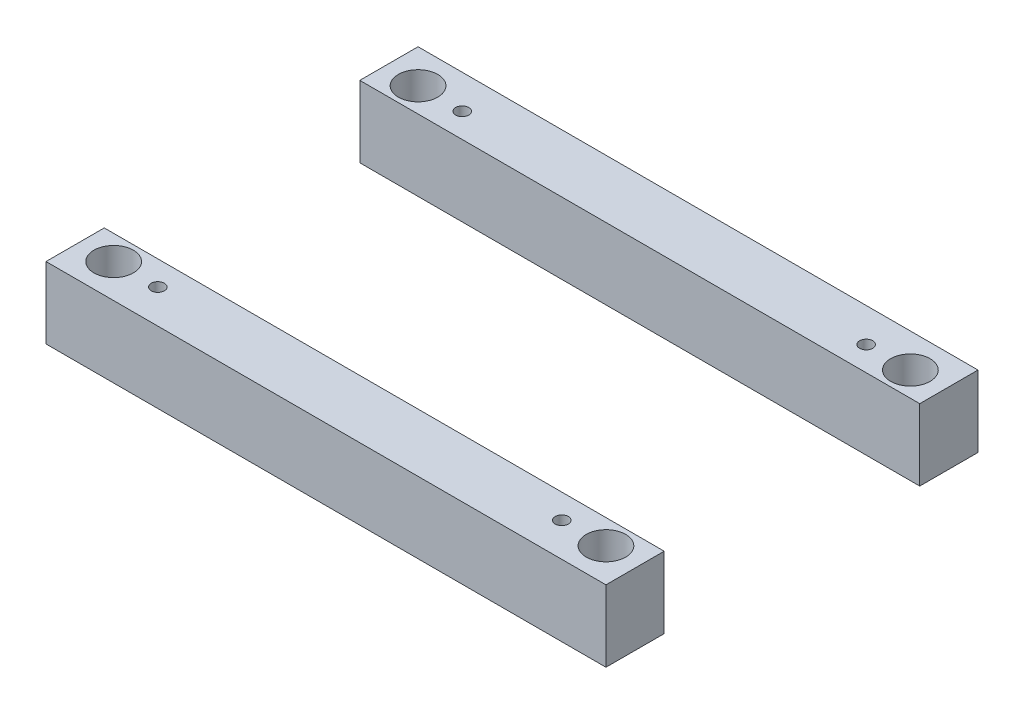
from build123d import *

# Parameters (mm, degrees)
SZKIC1_W                    = 596
SZKIC1_H                    = 396
SZKIC1_R                    = 24
SZKIC1_R_2                  = 21
DODANIE_WYCI_GNI_CIE1_DEPTH = 76
OTW_R_GWINTOWANY_M161_D     = 14
SZKIC4_W                    = 668.849986018
SZKIC4_H                    = 272
WYTNIJ_WYCI_GNI_CIE1_DEPTH  = 108


with BuildPart() as part:
    # Szkic1 → Dodanie-wyciągnięcie1 (new body)
    # profile 1 of 5: a face of its own
    with BuildSketch(Plane(origin=(0, 0, 0), x_dir=(1, 0, 0), z_dir=(0, 1, 0))):
        with Locations((298, 198)):
            Rectangle(SZKIC1_W, SZKIC1_H)
        with Locations((560, 360)):
            Circle(SZKIC1_R, mode=Mode.SUBTRACT)
        with Locations((36, 360)):
            Circle(SZKIC1_R, mode=Mode.SUBTRACT)
        with Locations((560, 36)):
            Circle(SZKIC1_R, mode=Mode.SUBTRACT)
        with Locations((36, 36)):
            Circle(SZKIC1_R, mode=Mode.SUBTRACT)
    # profile 2 of 5: a face of its own
    with BuildSketch(Plane(origin=(0, 0, 0), x_dir=(1, 0, 0), z_dir=(0, 1, 0))):
        with Locations((36, 36)):
            Circle(SZKIC1_R)
        with Locations(Location((36, 36, 0), (0, 0, 270))):
            Circle(SZKIC1_R_2, mode=Mode.SUBTRACT)
    # profile 3 of 5: a face of its own
    with BuildSketch(Plane(origin=(0, 0, 0), x_dir=(1, 0, 0), z_dir=(0, 1, 0))):
        with Locations((560, 36)):
            Circle(SZKIC1_R)
        with Locations(Location((560, 36, 0), (0, 0, 270))):
            Circle(SZKIC1_R_2, mode=Mode.SUBTRACT)
    # profile 4 of 5: a face of its own
    with BuildSketch(Plane(origin=(0, 0, 0), x_dir=(1, 0, 0), z_dir=(0, 1, 0))):
        with Locations((560, 360)):
            Circle(SZKIC1_R)
        with Locations(Location((560, 360, 0), (0, 0, 270))):
            Circle(SZKIC1_R_2, mode=Mode.SUBTRACT)
    # profile 5 of 5: a face of its own
    with BuildSketch(Plane(origin=(0, 0, 0), x_dir=(1, 0, 0), z_dir=(0, 1, 0))):
        with Locations((36, 360)):
            Circle(SZKIC1_R)
        with Locations(Location((36, 360, 0), (0, 0, 270))):
            Circle(SZKIC1_R_2, mode=Mode.SUBTRACT)
    extrude(amount=-DODANIE_WYCI_GNI_CIE1_DEPTH)

    # Otwór gwintowany M161 (through all)
    with Locations(Plane(origin=(83, 0, -360), x_dir=(0, 0, 1), z_dir=(0, 1, 0))):
        with Locations((0, 0), (0, 430), (324, 0), (324, 430)):
            Hole(OTW_R_GWINTOWANY_M161_D / 2)

    # Szkic4 → Wytnij-wyciągnięcie1 (cut)
    with BuildSketch(Plane(origin=(0, 0, 0), x_dir=(1, 0, 0), z_dir=(0, 1, 0))):
        with Locations((297.106611773, 198)):
            Rectangle(SZKIC4_W, SZKIC4_H)
    extrude(amount=-WYTNIJ_WYCI_GNI_CIE1_DEPTH, mode=Mode.SUBTRACT)


with BuildPart() as wytnij_wyci_gni_cie1_piece_1:
    # of the separate pieces the step leaves, piece 1, a body of its own (wytnij_wyci_gni_cie1_pieces)
    add(part.part.solids().sort_by_distance((0, 0, 0))[0])


with BuildPart() as wytnij_wyci_gni_cie1_piece_2:
    # of the separate pieces the step leaves, piece 2, a body of its own (wytnij_wyci_gni_cie1_pieces)
    add(part.part.solids().sort_by_distance((0, 0, -396))[0])


solid = Compound([wytnij_wyci_gni_cie1_piece_1.part, wytnij_wyci_gni_cie1_piece_2.part])
